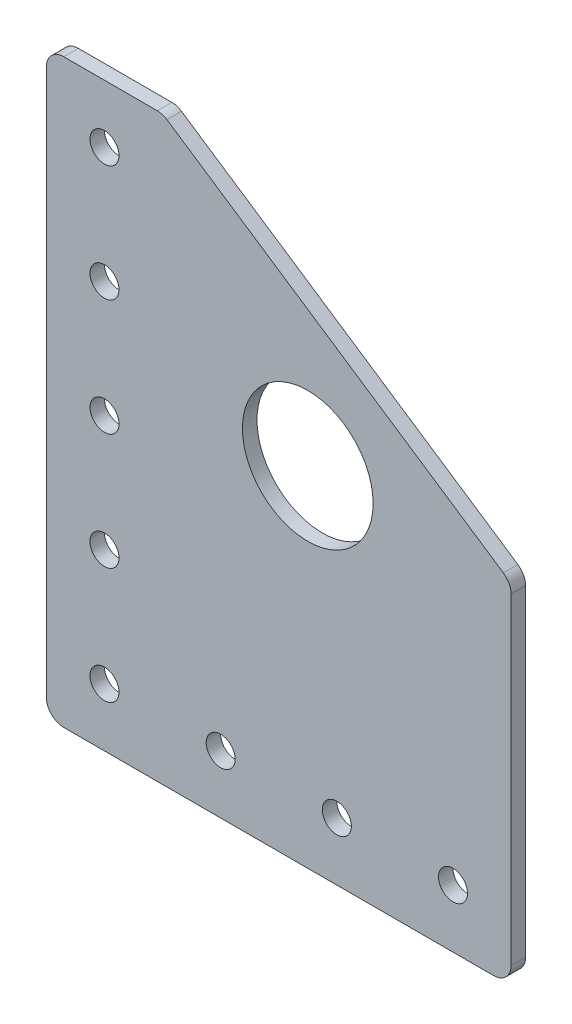
from build123d import *

# Parameters (mm, degrees)
SKETCH1_R           = 14.2875
SKETCH1_R_2         = 3.175
BOSS_EXTRUDE1_DEPTH = 3.175
FILLET1_R           = 3.81


with BuildPart() as part:
    # Sketch1 → Boss-Extrude1 (new body)
    with BuildSketch(Plane.XY):
        Polygon((0, 0), (0, 127), (25.4, 127), (101.6, 76.2), (101.6, 0), align=None)
        with Locations((57.15, 76.2)):
            Circle(SKETCH1_R, mode=Mode.SUBTRACT)
        with Locations((12.7, 12.7)):
            Circle(SKETCH1_R_2, mode=Mode.SUBTRACT)
        with Locations((38.1, 12.7)):
            Circle(SKETCH1_R_2, mode=Mode.SUBTRACT)
        with Locations((63.5, 12.7)):
            Circle(SKETCH1_R_2, mode=Mode.SUBTRACT)
        with Locations((88.9, 12.7)):
            Circle(SKETCH1_R_2, mode=Mode.SUBTRACT)
        with Locations((12.7, 38.1)):
            Circle(SKETCH1_R_2, mode=Mode.SUBTRACT)
        with Locations((12.7, 63.5)):
            Circle(SKETCH1_R_2, mode=Mode.SUBTRACT)
        with Locations((12.7, 88.9)):
            Circle(SKETCH1_R_2, mode=Mode.SUBTRACT)
        with Locations((12.7, 114.3)):
            Circle(SKETCH1_R_2, mode=Mode.SUBTRACT)
    extrude(amount=BOSS_EXTRUDE1_DEPTH)

    # Fillet1
    fillet1_edges = [part.edges().sort_by_distance(p)[0] for p in [
        (0, 0, 1.5875),
        (0, 127, 1.5875),
        (25.4, 127, 1.5875),
        (101.6, 76.2, 1.5875),
        (101.6, 0, 1.5875),
    ]]
    fillet(fillet1_edges, radius=FILLET1_R)


solid = part.part
